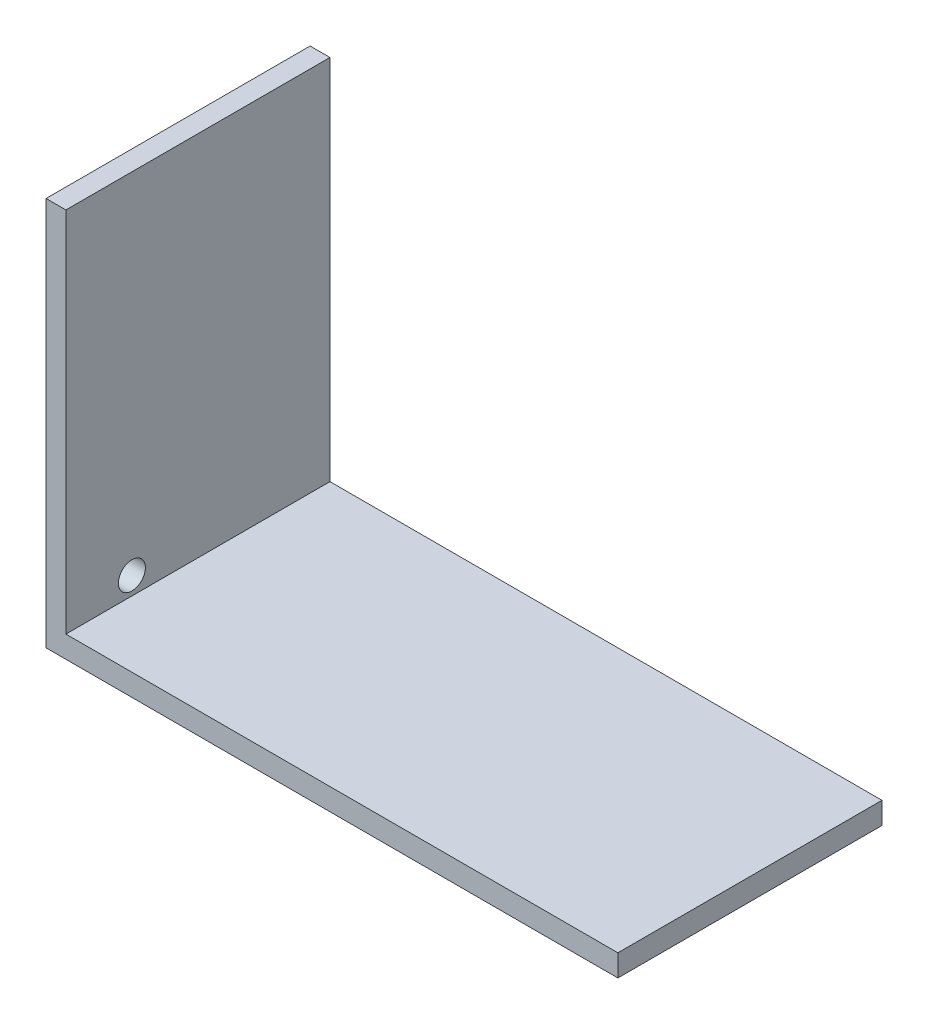
from build123d import *

# Parameters (mm, degrees)
SKETCH1_W            = 69.5
SKETCH1_H            = 33.25
BOSS_EXTRUDE1_DEPTH  = 2.75
SKETCH2_W            = 33.25
SKETCH2_H            = 49
BOSS_EXTRUDE2_DEPTH  = 2.5
M3_CLEARANCE_HOLE1_D = 3.4


with BuildPart() as part:
    # Sketch1 → Boss-Extrude1 (new body)
    with BuildSketch(Plane(origin=(0, 0, 0), x_dir=(1, 0, 0), z_dir=(0, 1, 0))):
        with Locations((31.075, 14.125)):
            Rectangle(SKETCH1_W, SKETCH1_H)
    extrude(amount=BOSS_EXTRUDE1_DEPTH)

    # Sketch2 → Boss-Extrude2 (add)
    with BuildSketch(Plane.ZY.offset(3.675)):
        with Locations((-14.125, 24.5)):
            Rectangle(SKETCH2_W, SKETCH2_H)
    extrude(amount=BOSS_EXTRUDE2_DEPTH)

    # M3 Clearance Hole1 (through all)
    with Locations(Plane.ZY.offset(6.175)):
        with Locations((-5.8125, 5)):
            Hole(M3_CLEARANCE_HOLE1_D / 2)


solid = part.part
